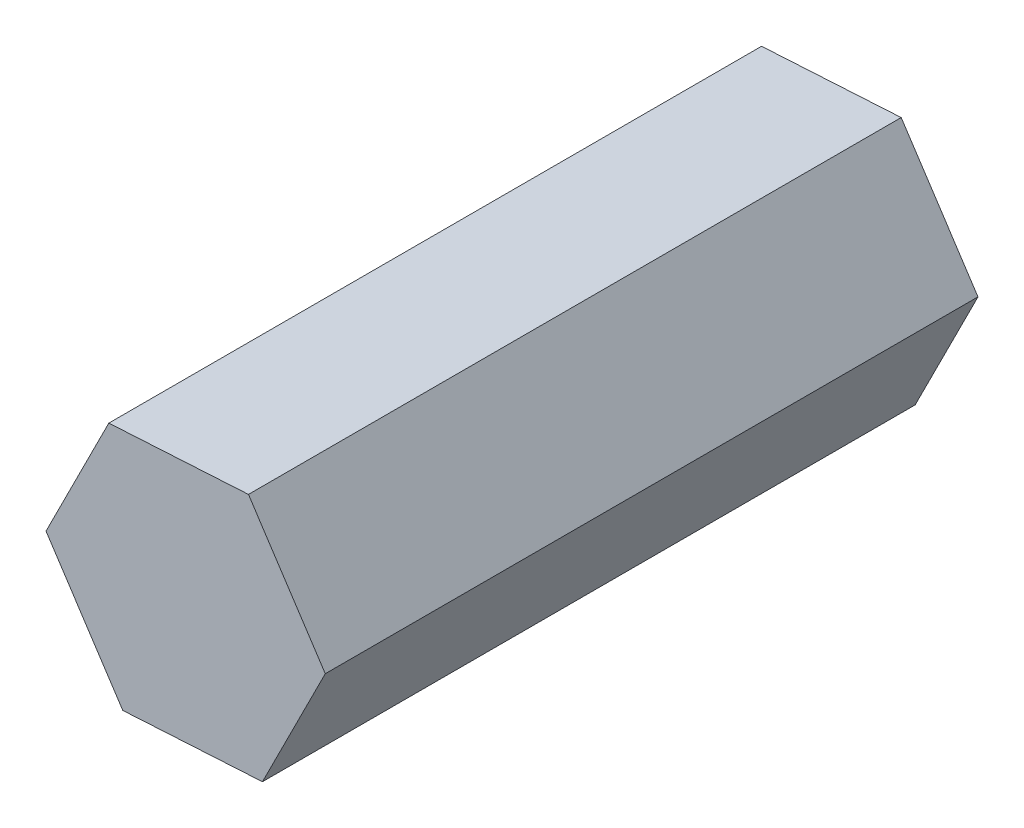
from build123d import *

# Parameters (mm, degrees)
BOSS_EXTRU_1_DEPTH = 14


with BuildPart() as part:
    # Esquisse1 → Boss.-Extru.1 (new body)
    with BuildSketch(Plane.XY):
        Polygon((1.347496268, 2.680345837), (-1.647499452, 2.507138918), (-2.99499572, -0.173206919), (-1.347496268, -2.680345837), (1.647499452, -2.507138918), (2.99499572, 0.173206919), align=None)
    extrude(amount=BOSS_EXTRU_1_DEPTH)


solid = part.part
